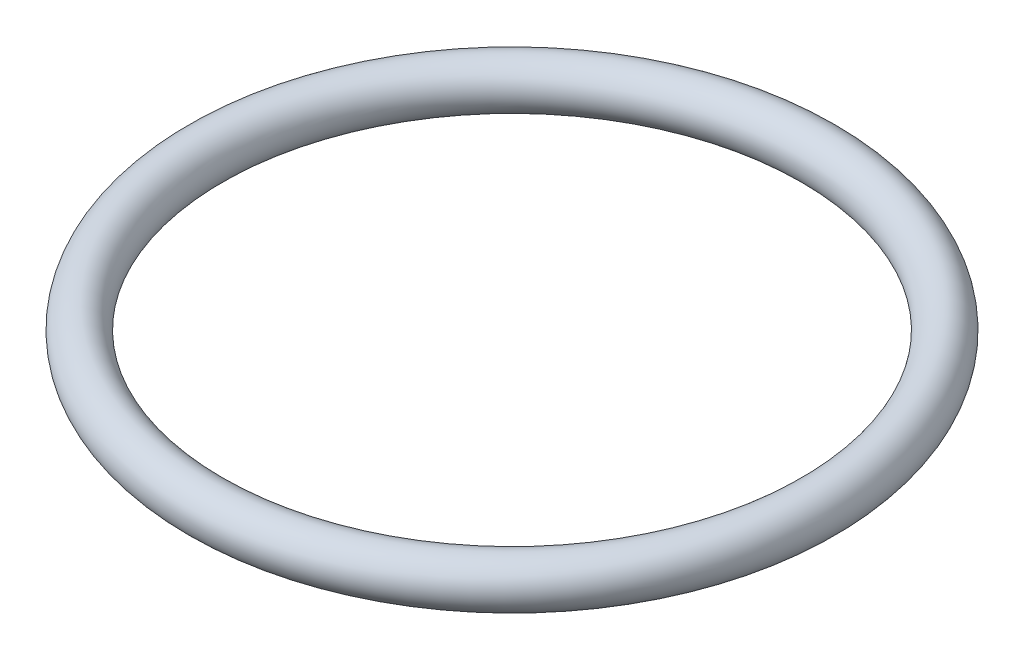
from build123d import *

# Parameters (mm, degrees)
SKETCH1_R = 1


with BuildPart() as part:
    # Sketch1 → Revolve1 (revolve)
    with BuildSketch(Plane.XY, mode=Mode.PRIVATE) as revolve1_sk:
        with Locations((13, 0)):
            Circle(SKETCH1_R)
    revolve(revolve1_sk.sketch.rotate(Axis((0, 0, 0), (0, 1, 0)), 90), axis=Axis((0, 0, 0), (0, 1, 0)))


solid = part.part
